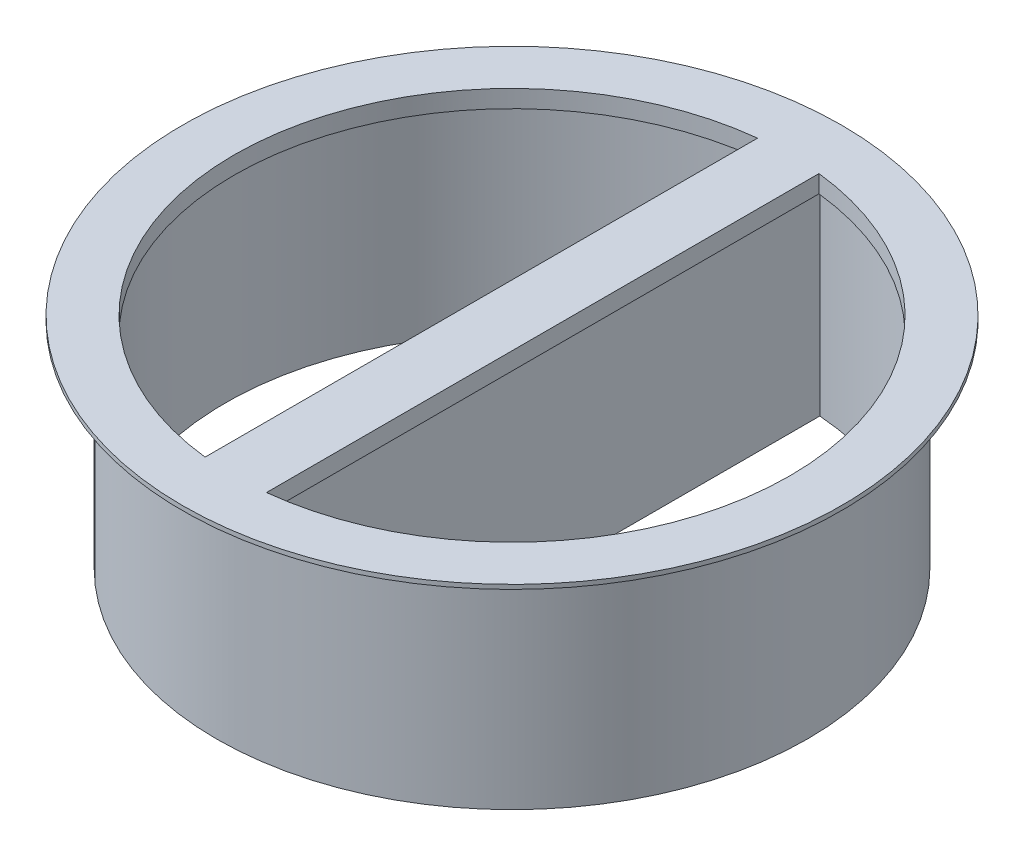
from build123d import *

# Parameters (mm, degrees)
OUTER_BASE_CIRCLE_SKETCH_R         = 37.585
BODY_EXTRUDE_DEPTH                 = 25
INNER_BASE_CIRCLE_SKETCH_OUTSIDE_W = 99.012
INNER_BASE_CIRCLE_SKETCH_OUTSIDE_H = 99.012
INNER_BASE_CIRCLE_SKETCH_OUTSIDE_R = 33.7
OUTER_BODY_EXTRUDE_DEPTH           = 24.5
DELIVERY_HOLE_EXTRUDE_DEPTH        = 59.738951727
FASTENER_EXTRUDE_DEPTH             = 23


with BuildPart() as part:
    # Outer Base Circle Sketch → Body Extrude (new body)
    with BuildSketch(Plane(origin=(0, 0, 0), x_dir=(1, 0, 0), z_dir=(0, 1, 0))):
        with Locations(Location((0, 0, 0), (0, 0, 270))):
            Circle(OUTER_BASE_CIRCLE_SKETCH_R)
    extrude(amount=BODY_EXTRUDE_DEPTH)

    # Inner Base Circle Sketch outside → Outer Body Extrude (cut)
    with BuildSketch(Plane.XZ):
        Rectangle(INNER_BASE_CIRCLE_SKETCH_OUTSIDE_W, INNER_BASE_CIRCLE_SKETCH_OUTSIDE_H)
        with Locations(Location((0, 0, 0), (0, 0, 270))):
            Circle(INNER_BASE_CIRCLE_SKETCH_OUTSIDE_R, mode=Mode.SUBTRACT)
    extrude(amount=-OUTER_BODY_EXTRUDE_DEPTH, mode=Mode.SUBTRACT)

    # Delivery Hole Sketch → Delivery Hole Extrude (cut, through all)
    with BuildSketch(Plane(origin=(0, 25, 0), x_dir=(1, 0, 0), z_dir=(0, 1, 0))):
        with BuildLine():
            Line((-3.5, 31.506189868), (-3.5, -31.506189868))
            ThreePointArc((-3.5, -31.506189868), (-31.7, 0), (-3.5, 31.506189868))
        make_face()
        with BuildLine():
            Line((3.5, 31.506189868), (3.5, -31.506189868))
            ThreePointArc((3.5, -31.506189868), (31.7, 0), (3.5, 31.506189868))
        make_face()
    extrude(amount=-DELIVERY_HOLE_EXTRUDE_DEPTH, mode=Mode.SUBTRACT)

    # Fastener Sketch → Fastener Extrude (cut)
    with BuildSketch(Plane.XZ):
        with BuildLine():
            Line((-2.5, 32.604294196), (-2.5, -32.604294196))
            ThreePointArc((-2.5, -32.604294196), (-32.7, 0), (-2.5, 32.604294196))
        make_face()
        with BuildLine():
            Line((2.5, 32.604294196), (2.5, -32.604294196))
            ThreePointArc((2.5, -32.604294196), (32.7, 0), (2.5, 32.604294196))
        make_face()
    extrude(amount=-FASTENER_EXTRUDE_DEPTH, mode=Mode.SUBTRACT)


solid = part.part
